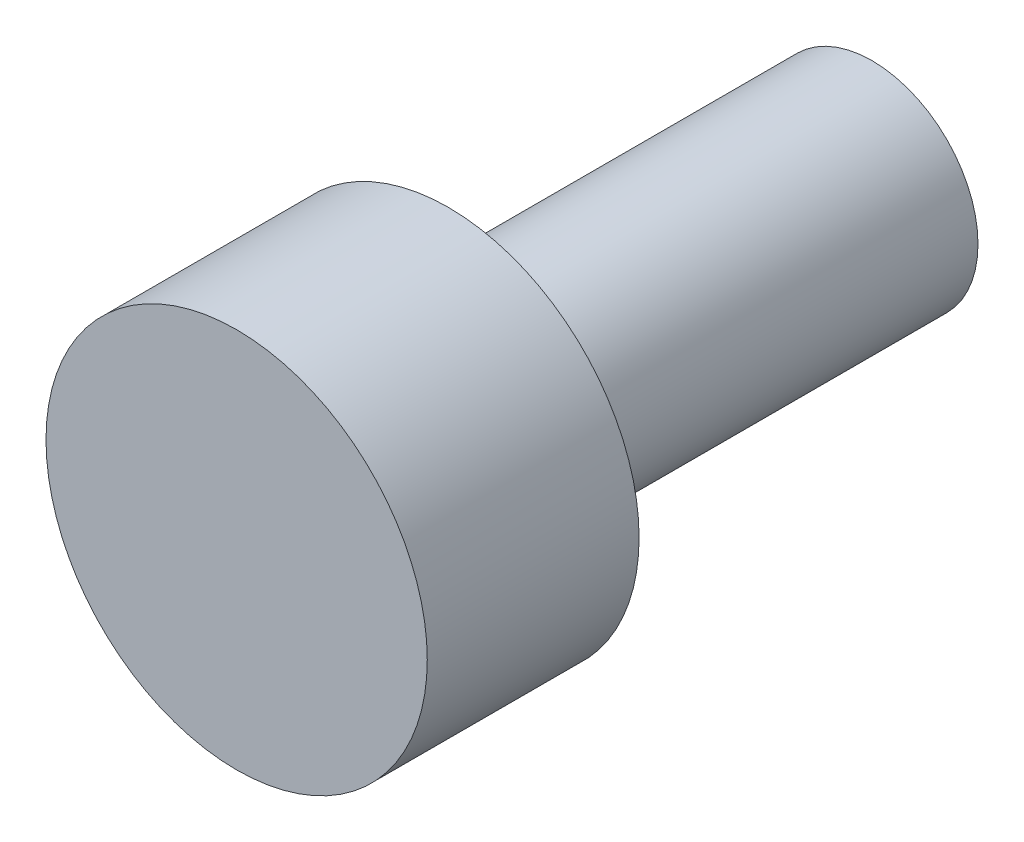
from build123d import *

# Parameters (mm, degrees)
SKETCH_1_R      = 1.8
EXTRUDE_1_DEPTH = 2
SKETCH_2_R      = 1
EXTRUDE_3_DEPTH = 4


with BuildPart() as part:
    # 草图1 → 凸台-拉伸1 (new body)
    with BuildSketch(Plane.XY):
        Circle(SKETCH_1_R)
    extrude(amount=EXTRUDE_1_DEPTH)

    # 草图2 → 凸台-拉伸3 (add)
    with BuildSketch(Plane(origin=(0, 0, 0), x_dir=(-1, 0, 0), z_dir=(0, 0, -1))):
        Circle(SKETCH_2_R)
    extrude(amount=EXTRUDE_3_DEPTH)


solid = part.part
